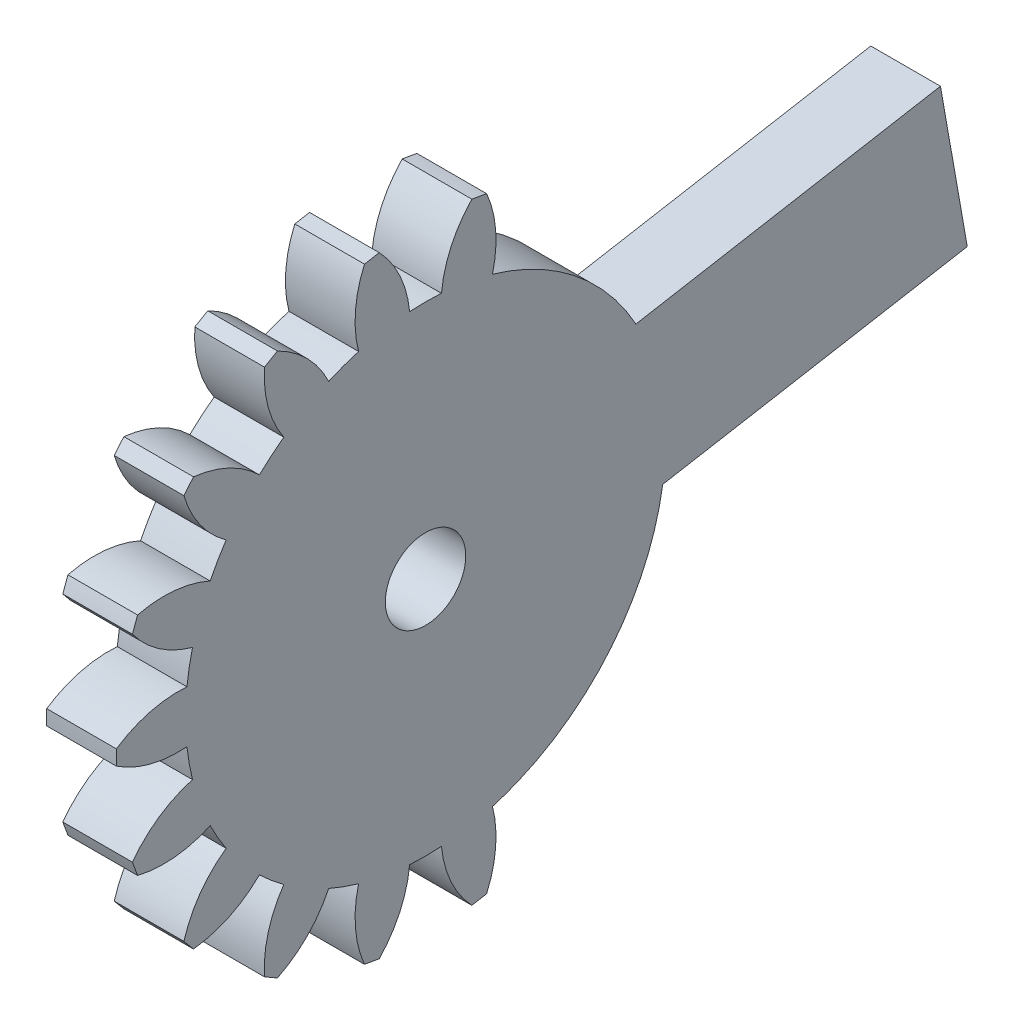
from build123d import *

# Parameters (mm, degrees)
BASPROSKE_W                  = 3.175
BASPROSKE_H                  = 12.7
TOOTHCUT_DEPTH               = 19.238986403
TEETHCUTS_COUNT              = 18
TEETHCUTS_ANGLE              = 340
BORSKE_R                     = 1.5875
BORE_DEPTH                   = 50.8000508
CUT_EXTRUDE_THIN1_DEPTH      = 1
CUT_EXTRUDE_THIN1_DEPTH_BACK = 5.08
BOSS_EXTRUDE1_DEPTH          = 3.175
CUT_EXTRUDE2_REACH           = 27.742
SKETCH9_R                    = 1.651
SCALE1_SCALE_X               = 1
SCALE1_SCALE_Y               = 1.11
SCALE1_SCALE_Z               = 1.11


with BuildPart() as part:
    # BasProSke → Base-Revolve (revolve)
    with BuildSketch(Plane(origin=(0, 0, 0), x_dir=(1, 0, 0), z_dir=(0, 1, 0)), mode=Mode.PRIVATE) as base_revolve_sk:
        with Locations((1.5875, 6.35)):
            Rectangle(BASPROSKE_W, BASPROSKE_H)
    revolve(base_revolve_sk.sketch.rotate(Axis((-10, 0, 0), (1, 0, 0)), 180), axis=Axis((-10, 0, 0), (1, 0, 0)))

    # TooCutSke → ToothCut (cut, through all)
    with BuildSketch(Plane(origin=(0, 0, 0), x_dir=(0, 0, -1), z_dir=(1, 0, 0))):
        with BuildLine():
            ThreePointArc((0.653663469, 9.833498417), (0, 9.8552), (-0.653663469, 9.833498417))
            ThreePointArc((-0.653663469, 9.833498417), (-1.05484238, 11.314407704), (-1.923354389, 12.579209556))
            ThreePointArc((-1.923354389, 12.579209556), (0, 12.7254), (1.923354389, 12.579209556))
            ThreePointArc((1.923354389, 12.579209556), (1.05484238, 11.314407704), (0.653663469, 9.833498417))
        make_face()
    toothcut = extrude(amount=TOOTHCUT_DEPTH, mode=Mode.SUBTRACT)

    # TeethCuts: ToothCut ×18 about axis
    teethcuts_axis = Axis((-10, 0, 0), (1, 0, 0))
    for i in range(1, TEETHCUTS_COUNT):
        add(toothcut.rotate(teethcuts_axis, i * TEETHCUTS_ANGLE / (TEETHCUTS_COUNT - 1)), mode=Mode.SUBTRACT)

    # BorSke → Bore (cut, symmetric)
    with BuildSketch(Plane(origin=(0, 0, 0), x_dir=(0, 0, -1), z_dir=(1, 0, 0))):
        with Locations(Location((0, 0, 0), (0, 0, 180))):
            Circle(BORSKE_R)
    extrude(amount=BORE_DEPTH, both=True, mode=Mode.SUBTRACT)

    # Sketch7 → Cut-Extrude-Thin1 (cut, two sides: drawn at the far end of the back side and taken through both)
    with BuildSketch(Plane.ZY.offset(-CUT_EXTRUDE_THIN1_DEPTH_BACK)):
        with BuildLine():
            Line((-10.823936545, 10.290898732), (-25.264431922, 12.837147681))
            Line((-25.264431922, 12.837147681), (-28.131363335, -3.422028321))
            Line((-28.131363335, -3.422028321), (-13.690867959, -5.968277271))
            ThreePointArc((-13.690867959, -5.968277271), (-11.782416361, -9.177955314), (-9.137407483, -11.813889433))
            Line((-9.137407483, -11.813889433), (-10.123749891, -15.359323522))
            ThreePointArc((-10.123749891, -15.359323522), (18.392184669, -0.355912967), (-9.521946872, 15.739493597))
            Line((-9.521946872, 15.739493597), (-8.708557038, 12.133475733))
            ThreePointArc((-8.708557038, 12.133475733), (-9.809604931, 11.261964755), (-10.823936545, 10.290898732))
        make_face()
        with BuildLine():
            Line((-8.636682816, 4.746859697), (-21.143741279, 6.952191553))
            Line((-21.143741279, 6.952191553), (-22.246407207, 0.698662322))
            Line((-22.246407207, 0.698662322), (-9.739348744, -1.506669535))
            ThreePointArc((-9.739348744, -1.506669535), (-7.549024322, -6.335392555), (-3.17353646, -9.330253661))
            Line((-3.17353646, -9.330253661), (-4.102105036, -12.668018169))
            ThreePointArc((-4.102105036, -12.668018169), (13.313553301, -0.235050135), (-3.652381497, 12.804923251))
            Line((-3.652381497, 12.804923251), (-2.889344669, 9.422136405))
            ThreePointArc((-2.889344669, 9.422136405), (-6.219073923, 7.64513483), (-8.636682816, 4.746859697))
        make_face(mode=Mode.SUBTRACT)
    extrude(amount=CUT_EXTRUDE_THIN1_DEPTH + CUT_EXTRUDE_THIN1_DEPTH_BACK, mode=Mode.SUBTRACT)

    # Sketch8 → Boss-Extrude1 (add)
    with BuildSketch(Plane.ZY):
        Polygon((-21.143741279, 6.952191553), (-22.246407207, 0.698662322), (-9.739348744, -1.506669535), (-8.636682816, 4.746859697), align=None)
    extrude(amount=-BOSS_EXTRUDE1_DEPTH)

    # Sketch9 → Cut-Extrude2 (cut, up to next)
    with BuildSketch(Plane.ZY, mode=Mode.PRIVATE) as cut_extrude2_sk1:
        Circle(SKETCH9_R)
    cut_extrude2_tool1 = extrude(cut_extrude2_sk1.sketch, amount=-CUT_EXTRUDE2_REACH, mode=Mode.PRIVATE) & part.part
    add(cut_extrude2_tool1.solids().sort_by_distance((0, 0, 0))[0], mode=Mode.SUBTRACT)


with BuildPart() as part_1:
    # Scale1: scaled about (1.5875, 0.50323633, -2.169084726)
    add(part.part.scale((SCALE1_SCALE_X, SCALE1_SCALE_Y, SCALE1_SCALE_Z), about=(1.5875, 0.50323633, -2.169084726)))


solid = part_1.part
